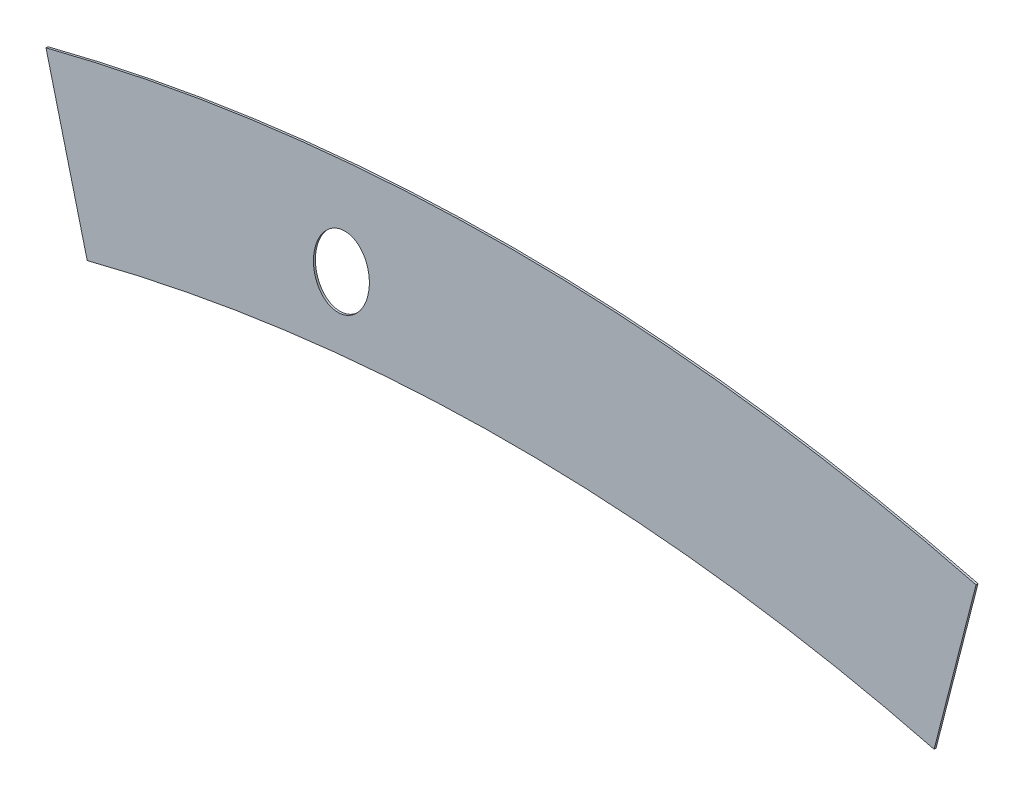
from build123d import *

# Parameters (mm, degrees)
SKETCH1_RX         = 60.325
SKETCH1_RY         = 44.45
BASE_EXTRUDE_DEPTH = 3.175


with BuildPart() as part:
    # Sketch1 → Base-Extrude (new body)
    with BuildSketch(Plane.XY):
        with BuildLine():
            Line((-752.475, -94.975135089), (-685.8, -359.762510313))
            ThreePointArc((-685.8, -359.762510313), (-0.61626002, -273.050068917), (684.6062, -359.456002227))
            Line((684.6062, -359.456002227), (752.475, -94.975135089))
            ThreePointArc((752.475, -94.975135089), (0, 0), (-752.475, -94.975135089))
        make_face()
        with Locations(Location((-274.458257632, -169.743861591), (0, 0, -101.7))):
            Ellipse(SKETCH1_RX, SKETCH1_RY, mode=Mode.SUBTRACT)
    extrude(amount=-BASE_EXTRUDE_DEPTH)


solid = part.part
